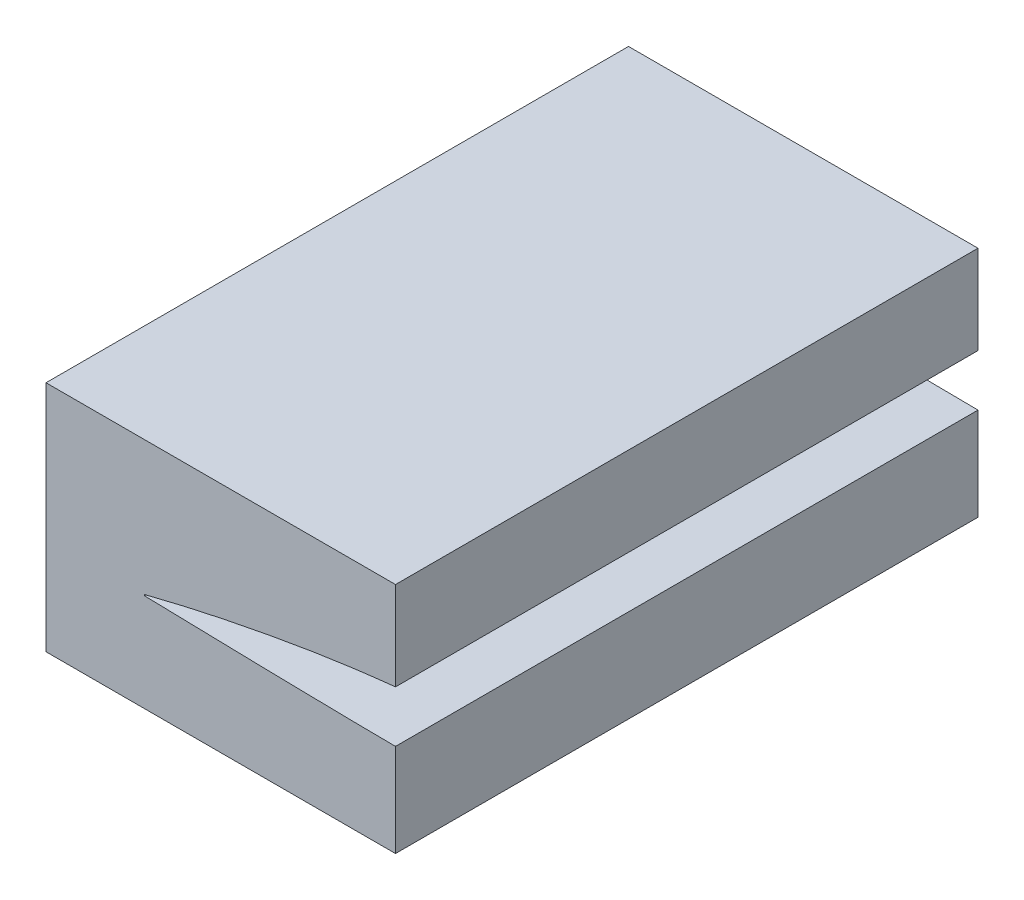
from build123d import *

# Parameters (mm, degrees)
BOSS_EXTRUDE1_DEPTH = 50


with BuildPart() as part:
    # Sketch2 → Boss-Extrude1 (new body)
    with BuildSketch(Plane(origin=(17.440169359, 0, 0), x_dir=(1, 0, 0), z_dir=(0, 0, 1))):
        with BuildLine():
            Line((-17.440169359, 5.390357249), (-17.440169359, 13))
            Line((-17.440169359, 13), (-47.440169359, 13))
            Line((-47.440169359, 13), (-47.440169359, -7))
            Line((-47.440169359, -7), (-17.440169359, -7))
            Line((-17.440169359, -7), (-17.440169359, 0.968636761))
            add(Edge.make_bspline(
                [(-17.440169359, 0.968636761), (-17.931338117, 0.970701913), (-19.758058993, 0.983079263), (-22.920319296, 1.034346952), (-26.927143731, 1.108696119), (-30.934784115, 1.186054987), (-34.274352572, 1.272646837), (-36.946538119, 1.3352315), (-38.282562813, 1.371072371), (-38.950621034, 1.388994037)],
                knots=[0.736257198, 0.736257198, 0.736257198, 0.736257198, 0.754320379, 0.803437364, 0.852566096, 0.901700994, 0.950848809, 0.975422717, 1, 1, 1, 1], degree=3))
            ThreePointArc((-38.950621034, 1.388994037), (-38.995095838, 1.439101765), (-38.955157451, 1.492895053))
            add(Edge.make_bspline(
                [(-38.955157451, 1.492895053), (-38.295450211, 1.65836191), (-36.977768402, 1.98886104), (-34.338118745, 2.604088974), (-31.033670068, 3.302340733), (-27.061704408, 4.049112578), (-23.086249568, 4.700839132), (-19.876307317, 5.123163604), (-17.993272478, 5.332934001), (-17.440169359, 5.390357249)],
                knots=[0, 0, 0, 0, 0.02501249, 0.049959286, 0.099672925, 0.14920632, 0.198581097, 0.24780517, 0.26825455, 0.26825455, 0.26825455, 0.26825455], degree=3))
        make_face()
    extrude(amount=BOSS_EXTRUDE1_DEPTH)


solid = part.part
